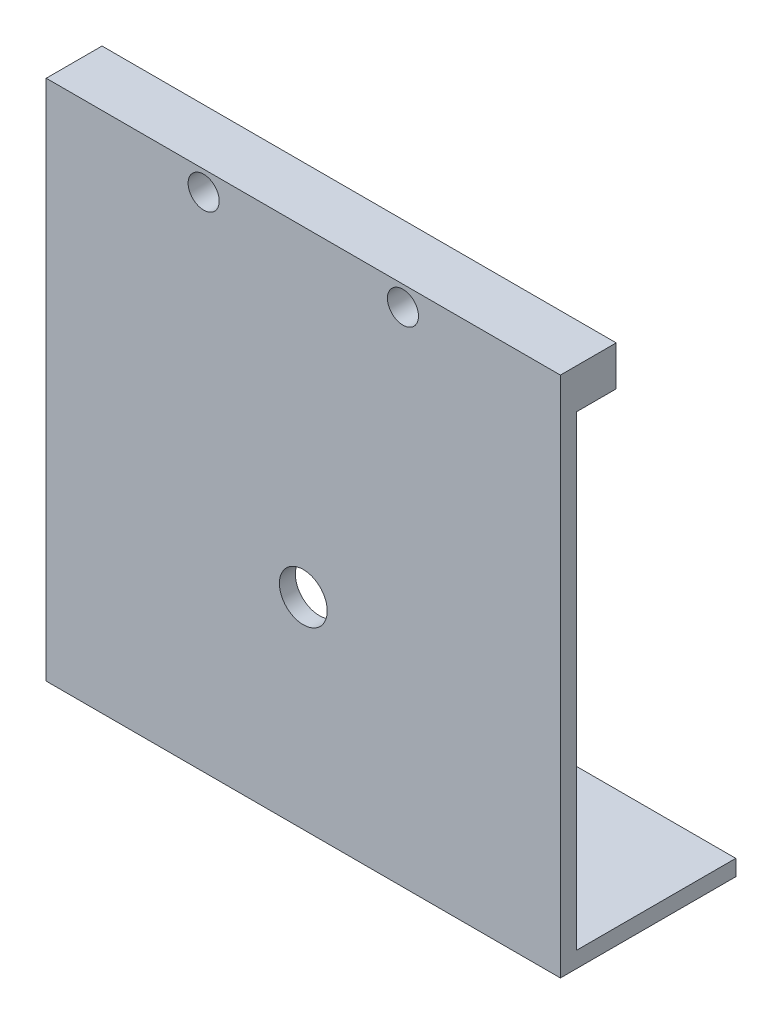
from build123d import *

# Parameters (mm, degrees)
CROQUIS1_W              = 64.5
CROQUIS1_H              = 53.5
SALIENTE_EXTRUIR1_DEPTH = 2
CROQUIS2_W              = 64.5
CROQUIS2_H              = 5
SALIENTE_EXTRUIR2_DEPTH = 5
CROQUIS3_W              = 64.5
CROQUIS3_H              = 2
SALIENTE_EXTRUIR3_DEPTH = 20
CROQUIS5_R              = 3
CORTAR_EXTRUIR1_DEPTH   = 20
CROQUIS7_W              = 5
CROQUIS7_H              = 5.397784026
CORTAR_EXTRUIR3_DEPTH   = 73.634788497
CROQUIS8_W              = 2
CROQUIS8_H              = 10
CROQUIS8_H_2            = 5
CROQUIS8_W_2            = 5
SALIENTE_EXTRUIR4_DEPTH = 64.5
CROQUIS9_R              = 1.95
CORTAR_EXTRUIR4_DEPTH   = 53.598716714


with BuildPart() as part:
    # Croquis1 → Saliente-Extruir1 (new body)
    with BuildSketch(Plane.XY):
        Rectangle(CROQUIS1_W, CROQUIS1_H)
    extrude(amount=SALIENTE_EXTRUIR1_DEPTH)

    # Croquis2 → Saliente-Extruir2 (add)
    with BuildSketch(Plane(origin=(0, 0, 0), x_dir=(-1, 0, 0), z_dir=(0, 0, -1))):
        with Locations((0, 24.25)):
            Rectangle(CROQUIS2_W, CROQUIS2_H)
    extrude(amount=SALIENTE_EXTRUIR2_DEPTH)

    # Croquis3 → Saliente-Extruir3 (add)
    with BuildSketch(Plane(origin=(0, 0, 0), x_dir=(-1, 0, 0), z_dir=(0, 0, -1))):
        with Locations((0, -25.75)):
            Rectangle(CROQUIS3_W, CROQUIS3_H)
    extrude(amount=SALIENTE_EXTRUIR3_DEPTH)

    # Croquis5 → Cortar-Extruir1 (cut)
    with BuildSketch(Plane(origin=(0, 0, 0), x_dir=(-1, 0, 0), z_dir=(0, 0, -1))):
        with Locations((0, -1.5)):
            Circle(CROQUIS5_R)
    extrude(amount=-CORTAR_EXTRUIR1_DEPTH, mode=Mode.SUBTRACT)

    # Croquis7 → Cortar-Extruir3 (cut, through all)
    with BuildSketch(Plane(origin=(32.25, 0, 0), x_dir=(0, 0, -1), z_dir=(1, 0, 0))):
        with Locations((2.5, 24.051107987)):
            Rectangle(CROQUIS7_W, CROQUIS7_H)
    extrude(amount=-CORTAR_EXTRUIR3_DEPTH, mode=Mode.SUBTRACT)

    # Croquis8 → Saliente-Extruir4 (add, through all)
    with BuildSketch(Plane(origin=(32.25, 0, 0), x_dir=(0, 0, -1), z_dir=(1, 0, 0))):
        with Locations((-1, 28.75)):
            Rectangle(CROQUIS8_W, CROQUIS8_H)
        with Locations((-1, 36.25)):
            Rectangle(CROQUIS8_W, CROQUIS8_H_2)
        with Locations((2.5, 36.25)):
            Rectangle(CROQUIS8_W_2, CROQUIS8_H_2)
    extrude(amount=-SALIENTE_EXTRUIR4_DEPTH)

    # Croquis9 → Cortar-Extruir4 (cut, through all)
    with BuildSketch(Plane(origin=(0, 0, -5), x_dir=(-1, 0, 0), z_dir=(0, 0, -1))):
        with Locations(Location((-12.5, 36.25, 0), (0, 0, 90))):
            Circle(CROQUIS9_R)
        with Locations(Location((12.5, 36.25, 0), (0, 0, 270))):
            Circle(CROQUIS9_R)
    extrude(amount=-CORTAR_EXTRUIR4_DEPTH, mode=Mode.SUBTRACT)


solid = part.part
